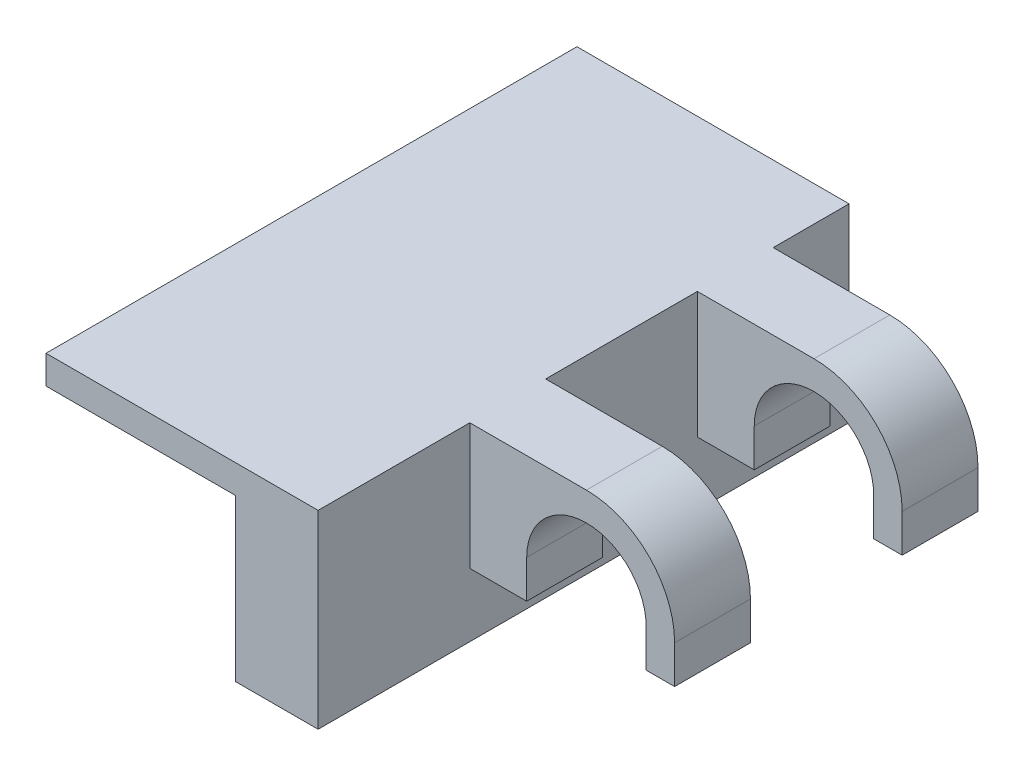
from build123d import *

# Parameters (mm, degrees)
AUFSATZ_LINEAR_AUSTRAGEN2_DEPTH = 14
SKIZZE3_W                       = 10.8
SKIZZE3_H                       = 4
SKIZZE3_H_2                     = 8
SCHNITT_LINEAR_AUSTRAGEN1_DEPTH = 201.389926144
SCHNITT_LINEAR_AUSTRAGEN2_DEPTH = 202.674849696


with BuildPart() as part:
    # Skizze1 → Aufsatz-Linear austragen2 (new, symmetric)
    with BuildSketch(Plane.XY):
        with BuildLine():
            Line((-198.15, 0), (-198.15, -2))
            Line((-198.15, -2), (-199.65, -2))
            Line((-199.65, -2), (-199.65, 0))
            ThreePointArc((-199.65, 0), (-198.288046533, 3.288046533), (-195, 4.65))
            Line((-195, 4.65), (195, 4.65))
            ThreePointArc((195, 4.65), (198.288046533, 3.288046533), (199.65, 0))
            Line((199.65, 0), (199.65, -2))
            Line((199.65, -2), (198.15, -2))
            Line((198.15, -2), (198.15, 0))
            ThreePointArc((198.15, 0), (195, 3.15), (191.85, 0))
            Line((191.85, 0), (191.85, -2))
            Line((191.85, -2), (188.85, -2))
            Line((188.85, -2), (188.85, -5.35))
            Line((188.85, -5.35), (-188.85, -5.35))
            Line((-188.85, -5.35), (-188.85, -2))
            Line((-188.85, -2), (-191.85, -2))
            Line((-191.85, -2), (-191.85, 0))
            ThreePointArc((-191.85, 0), (-195, 3.15), (-198.15, 0))
        make_face()
    extrude(amount=AUFSATZ_LINEAR_AUSTRAGEN2_DEPTH, both=True)

    # Skizze3 → Schnitt-Linear austragen1 (cut, through all)
    with BuildSketch(Plane.XZ.offset(5.35)):
        with Locations((-194.25, 12)):
            Rectangle(SKIZZE3_W, SKIZZE3_H)
        with Locations((-194.25, 2)):
            Rectangle(SKIZZE3_W, SKIZZE3_H_2)
        with Locations((-194.25, -10)):
            Rectangle(SKIZZE3_W, SKIZZE3_H_2)
        with Locations((194.25, 10)):
            Rectangle(SKIZZE3_W, SKIZZE3_H_2)
        with Locations((194.25, -2)):
            Rectangle(SKIZZE3_W, SKIZZE3_H_2)
        with Locations((194.25, -12)):
            Rectangle(SKIZZE3_W, SKIZZE3_H)
    extrude(amount=-SCHNITT_LINEAR_AUSTRAGEN1_DEPTH, mode=Mode.SUBTRACT)

    # Skizze4 → Schnitt-Linear austragen2 (cut, through all)
    with BuildSketch(Plane.XY.offset(14)):
        Polygon((174.5, 4.65), (174.5, 3.15), (184.5, 3.15), (184.5, -5.35), (-199.65, -5.35), (-199.65, 4.65), align=None)
    extrude(amount=-SCHNITT_LINEAR_AUSTRAGEN2_DEPTH, mode=Mode.SUBTRACT)


solid = part.part
